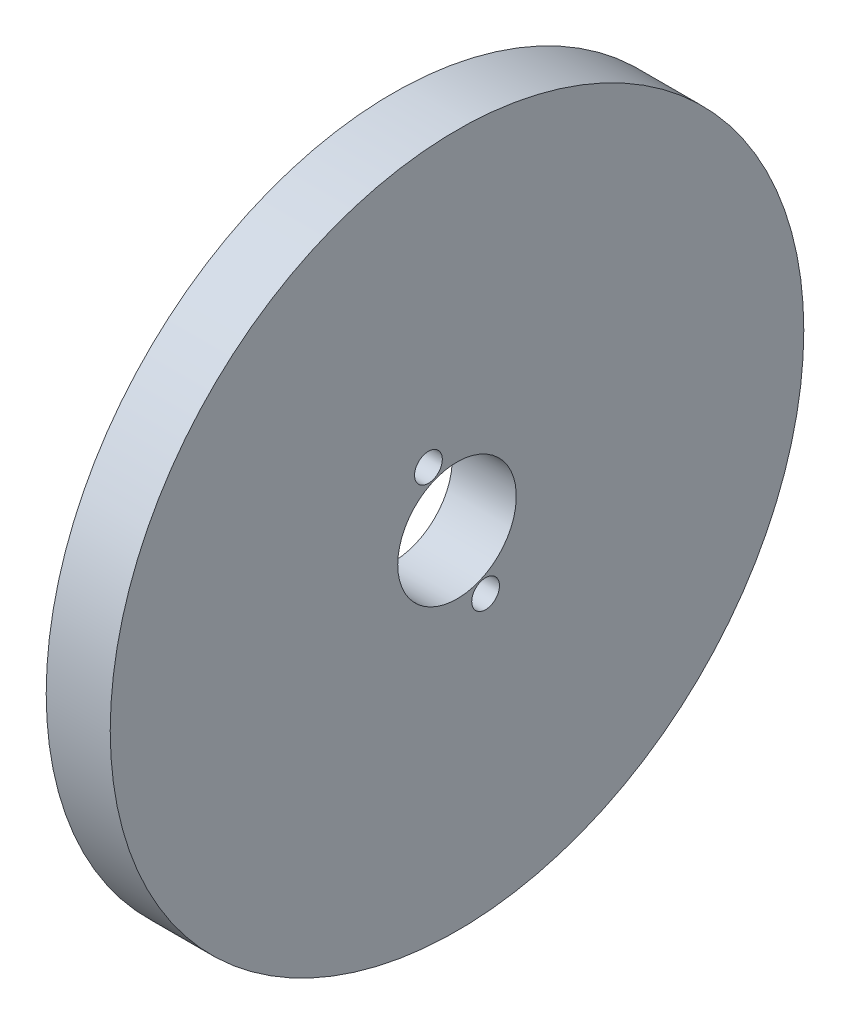
from build123d import *

# Parameters (mm, degrees)
AXIAL_PROFILE_MM_W     = 12
AXIAL_PROFILE_MM_H     = 53.8875
AXIAL_HOLES_DEPTH      = 96.448886845
AXIAL_HOLES_DEPTH_BACK = 96.448886845
SKETCH2_R              = 2.6


with BuildPart() as part:
    # Axial profile (mm) → Full revolution (revolve)
    with BuildSketch(Plane.XY, mode=Mode.PRIVATE) as full_revolution_sk:
        with Locations((19.7, 38.05625)):
            Rectangle(AXIAL_PROFILE_MM_W, AXIAL_PROFILE_MM_H)
    revolve(full_revolution_sk.sketch.rotate(Axis((-110, 0, 0), (1, 0, 0)), 90), axis=Axis((-110, 0, 0), (1, 0, 0)))

    # Sketch2 → Axial holes (cut, two sides: drawn at the far end of the back side and taken through both)
    with BuildSketch(Plane(origin=(0, 0, 0), x_dir=(0, 0, -1), z_dir=(1, 0, 0)).offset(-AXIAL_HOLES_DEPTH_BACK)):
        with Locations(Location((-5.357568053, 12.934313455, 0), (0, 0, 180))):
            Circle(SKETCH2_R)
        with Locations(Location((5.357568053, -12.934313455, 0), (0, 0, 180))):
            Circle(SKETCH2_R)
    extrude(amount=AXIAL_HOLES_DEPTH + AXIAL_HOLES_DEPTH_BACK, mode=Mode.SUBTRACT)


solid = part.part
